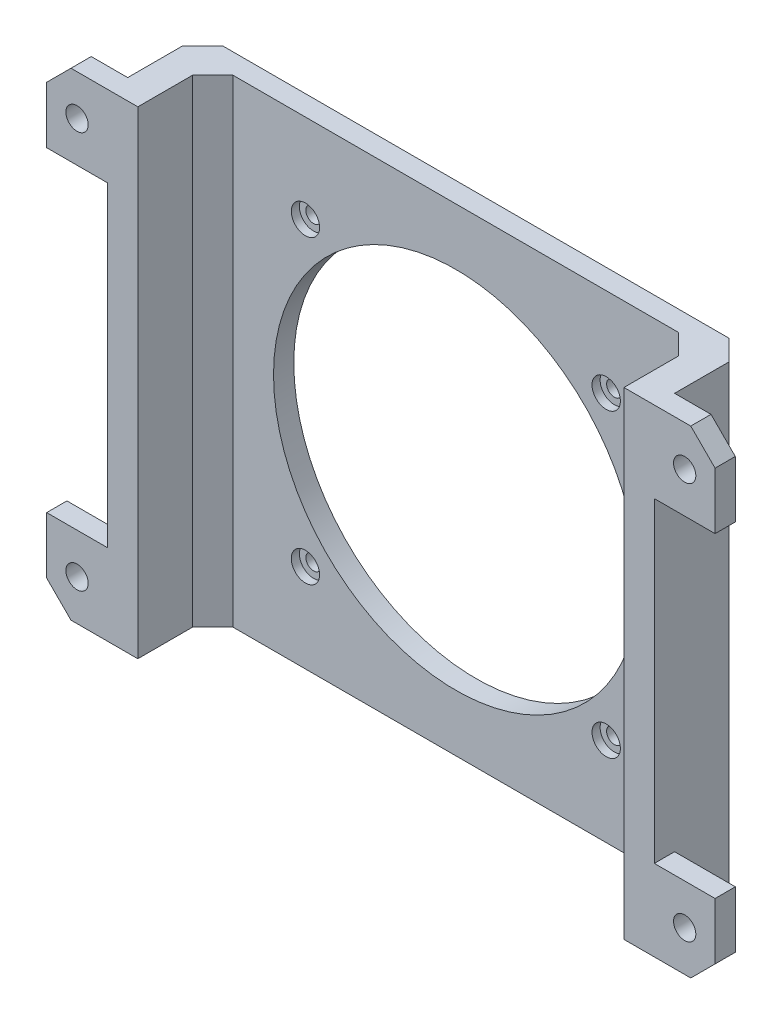
from build123d import *

# Parameters (mm, degrees)
EXTRUDE_5_DEPTH     = 118
SKETCH_8_R          = 45
CUT_EXTRUDE_2_DEPTH = 130
CHAMFER_1_SIZE      = 6
SKETCH_9_W          = 30
SKETCH_9_H          = 78
CUT_EXTRUDE_3_DEPTH = 130
CHAMFER_2_SIZE      = 5
CHAMFER_3_SIZE      = 5
SKETCH_10_R         = 2.75
CUT_EXTRUDE_4_DEPTH = 146.163700697
SKETCH_14_R         = 1.9
CUT_EXTRUDE_5_DEPTH = 146.163700697
SKETCH_15_R         = 3.5
CUT_EXTRUDE_6_DEPTH = 2


with BuildPart() as part:
    # 草图7 → 凸台-拉伸5 (new body)
    with BuildSketch(Plane(origin=(0, 0, 0), x_dir=(1, 0, 0), z_dir=(0, 1, 0))):
        Polygon((-67.5, 0), (67.5, 0), (67.5, -18.5), (82.5, -18.5), (82.5, -23.5), (60, -23.5), (60, -5), (-60, -5), (-60, -23.5), (-82.5, -23.5), (-82.5, -18.5), (-67.5, -18.5), align=None)
    extrude(amount=EXTRUDE_5_DEPTH)

    # 草图8 → 切除-拉伸2 (cut)
    with BuildSketch(Plane(origin=(0, 0, 0), x_dir=(-1, 0, 0), z_dir=(0, 0, -1))):
        with Locations((0, 59)):
            Circle(SKETCH_8_R)
    extrude(amount=-CUT_EXTRUDE_2_DEPTH, mode=Mode.SUBTRACT)

    # 倒角1
    chamfer_1_edges = [part.edges().sort_by_distance(p)[0] for p in [
        (82.5, 0, 21),
        (-82.5, 0, 21),
        (-82.5, 118, 21),
        (82.5, 118, 21),
    ]]
    chamfer(chamfer_1_edges, length=CHAMFER_1_SIZE)

    # 草图9 → 切除-拉伸3 (cut)
    with BuildSketch(Plane(origin=(0, 0, 18.5), x_dir=(-1, 0, 0), z_dir=(0, 0, -1))):
        with Locations((-82.5, 59)):
            Rectangle(SKETCH_9_W, SKETCH_9_H)
        with Locations((82.5, 59)):
            Rectangle(SKETCH_9_W, SKETCH_9_H)
    extrude(amount=-CUT_EXTRUDE_3_DEPTH, mode=Mode.SUBTRACT)

    # 倒角2
    chamfer_2_edges = [part.edges().sort_by_distance(p)[0] for p in [
        (-67.5, 59, 0),
        (67.5, 59, 0),
    ]]
    chamfer(chamfer_2_edges, length=CHAMFER_2_SIZE)

    # 倒角3
    chamfer_3_edges = [part.edges().sort_by_distance(p)[0] for p in [
        (60, 59, 5),
        (-60, 59, 5),
    ]]
    chamfer(chamfer_3_edges, length=CHAMFER_3_SIZE)

    # 草图10 → 切除-拉伸4 (cut, through all)
    with BuildSketch(Plane(origin=(0, 0, 18.5), x_dir=(-1, 0, 0), z_dir=(0, 0, -1))):
        with Locations((75, 10)):
            Circle(SKETCH_10_R)
        with Locations((-75, 10)):
            Circle(SKETCH_10_R)
        with Locations((-75, 108)):
            Circle(SKETCH_10_R)
        with Locations((75, 108)):
            Circle(SKETCH_10_R)
    extrude(amount=-CUT_EXTRUDE_4_DEPTH, mode=Mode.SUBTRACT)

    # 草图14 → 切除-拉伸5 (cut, through all)
    with BuildSketch(Plane.XY.offset(5)):
        with Locations((-37.123106012, 96.123106012)):
            Circle(SKETCH_14_R)
        with Locations((-37.123106012, 21.876893988)):
            Circle(SKETCH_14_R)
        with Locations((37.123106012, 21.876893988)):
            Circle(SKETCH_14_R)
        with Locations((37.123106012, 96.123106012)):
            Circle(SKETCH_14_R)
    extrude(amount=-CUT_EXTRUDE_5_DEPTH, mode=Mode.SUBTRACT)

    # 草图15 → 切除-拉伸6 (cut)
    with BuildSketch(Plane.XY.offset(5)):
        with Locations((-37.123106012, 96.123106012)):
            Circle(SKETCH_15_R)
        with Locations((37.123106012, 96.123106012)):
            Circle(SKETCH_15_R)
        with Locations((37.123106012, 21.876893988)):
            Circle(SKETCH_15_R)
        with Locations((-37.123106012, 21.876893988)):
            Circle(SKETCH_15_R)
    extrude(amount=-CUT_EXTRUDE_6_DEPTH, mode=Mode.SUBTRACT)


solid = part.part
